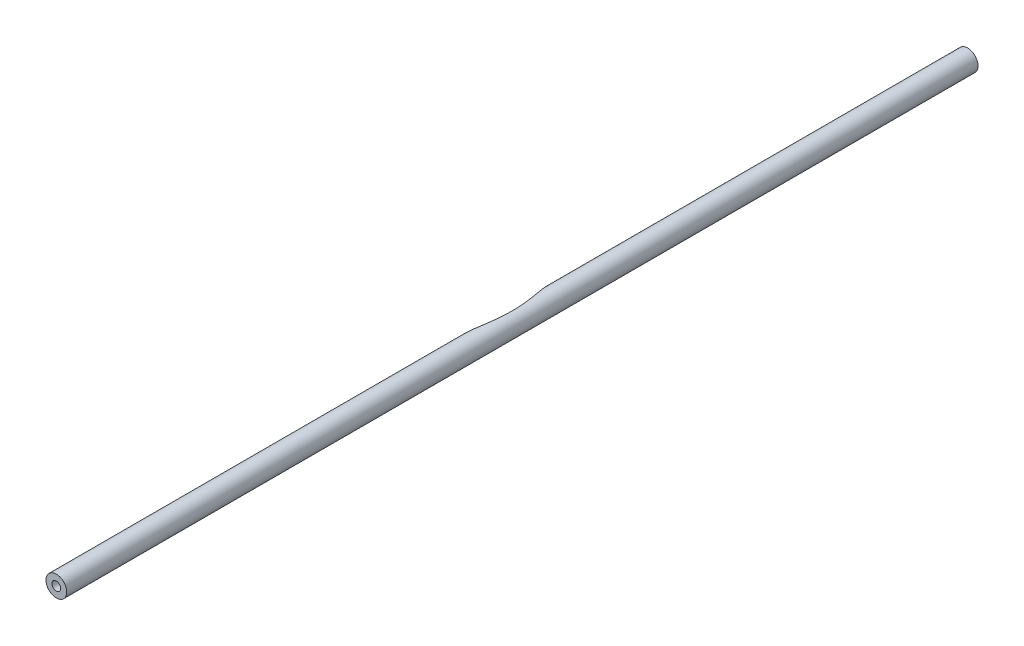
from build123d import *

# Parameters (mm, degrees)
SALIENTE_EXTRUIR1_DEPTH      = 220
SALIENTE_EXTRUIR1_DEPTH_BACK = 220
CROQUIS1_R                   = 5
CORTAR_EXTRUIR1_DEPTH        = 221.113607031
CORTAR_EXTRUIR1_DEPTH_BACK   = 221.113607031
CROQUIS6_R                   = 58.510219283


with BuildPart() as part:
    # Croquis1 → Saliente-Extruir1 (new, two sides: drawn at the far end of the back side and taken through both)
    with BuildSketch(Plane.XY.offset(-SALIENTE_EXTRUIR1_DEPTH_BACK)):
        Circle(CROQUIS1_R)
    extrude(amount=SALIENTE_EXTRUIR1_DEPTH + SALIENTE_EXTRUIR1_DEPTH_BACK)

    # Croquis5 → Perforador para roscar para macho de roscar para M5x0.81 (revolve, cut)
    with BuildSketch(Plane(origin=(0, 0, 220), x_dir=(0, -1, 0), z_dir=(1, 0, 0))):
        Polygon((0, 0), (0, 41.2618073), (2.1, 40), (2.1, 0), align=None)
    perforador_para_roscar_para_macho_de_ros = revolve(axis=Axis((0, 0, 226.35), (0, 0, -1)), mode=Mode.SUBTRACT)

    # Simetría2: Perforador para roscar para macho de roscar para M5x0.81 across plane
    add(perforador_para_roscar_para_macho_de_ros.mirror(Plane.XY), mode=Mode.SUBTRACT)

    # Croquis6 → Cortar-Extruir1 (cut, two sides: drawn at the far end of the back side and taken through both)
    with BuildSketch(Plane(origin=(0, 0, 0), x_dir=(1, 0, 0), z_dir=(0, 1, 0)).offset(-CORTAR_EXTRUIR1_DEPTH_BACK)):
        with Locations((-58.510219283, 0)):
            Circle(CROQUIS6_R)
    extrude(amount=CORTAR_EXTRUIR1_DEPTH + CORTAR_EXTRUIR1_DEPTH_BACK, mode=Mode.SUBTRACT)


solid = part.part
